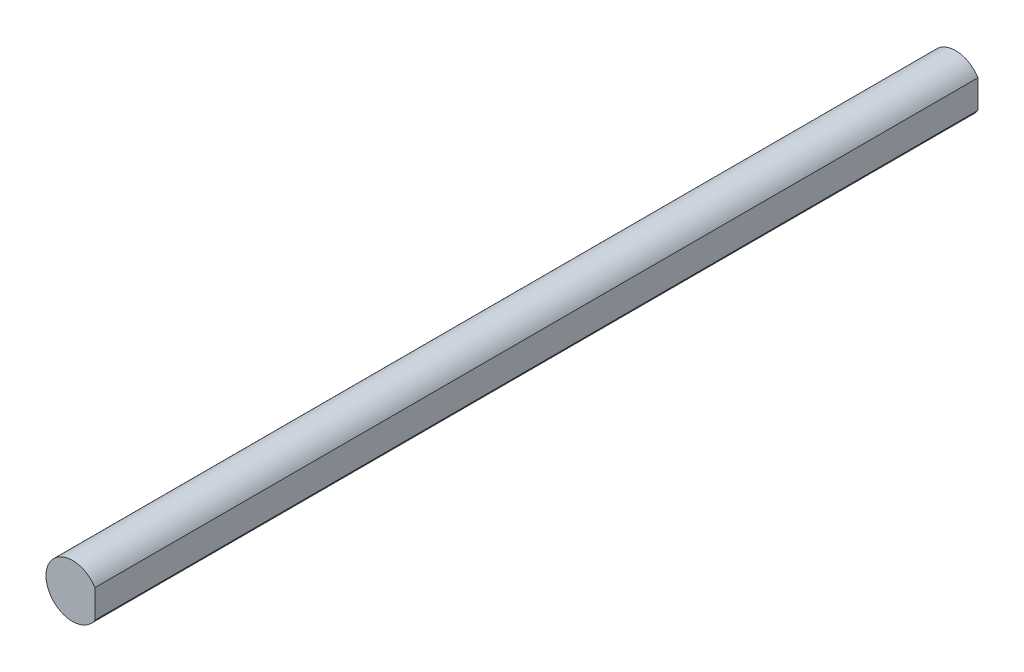
from build123d import *

# Parameters (mm, degrees)
SKETCH1_R           = 3
BOSS_EXTRUDE1_DEPTH = 100
CUT_EXTRUDE1_DEPTH  = 101.089959536


with BuildPart() as part:
    # Sketch1 → Boss-Extrude1 (new body)
    with BuildSketch(Plane.XY):
        Circle(SKETCH1_R)
    extrude(amount=BOSS_EXTRUDE1_DEPTH)

    # Sketch2 → Cut-Extrude1 (cut, through all)
    with BuildSketch(Plane.XY.offset(100)):
        with BuildLine():
            Line((2.54, 1.596370884), (2.54, -1.596370884))
            ThreePointArc((2.54, -1.596370884), (3, 0), (2.54, 1.596370884))
        make_face()
    extrude(amount=-CUT_EXTRUDE1_DEPTH, mode=Mode.SUBTRACT)


solid = part.part
